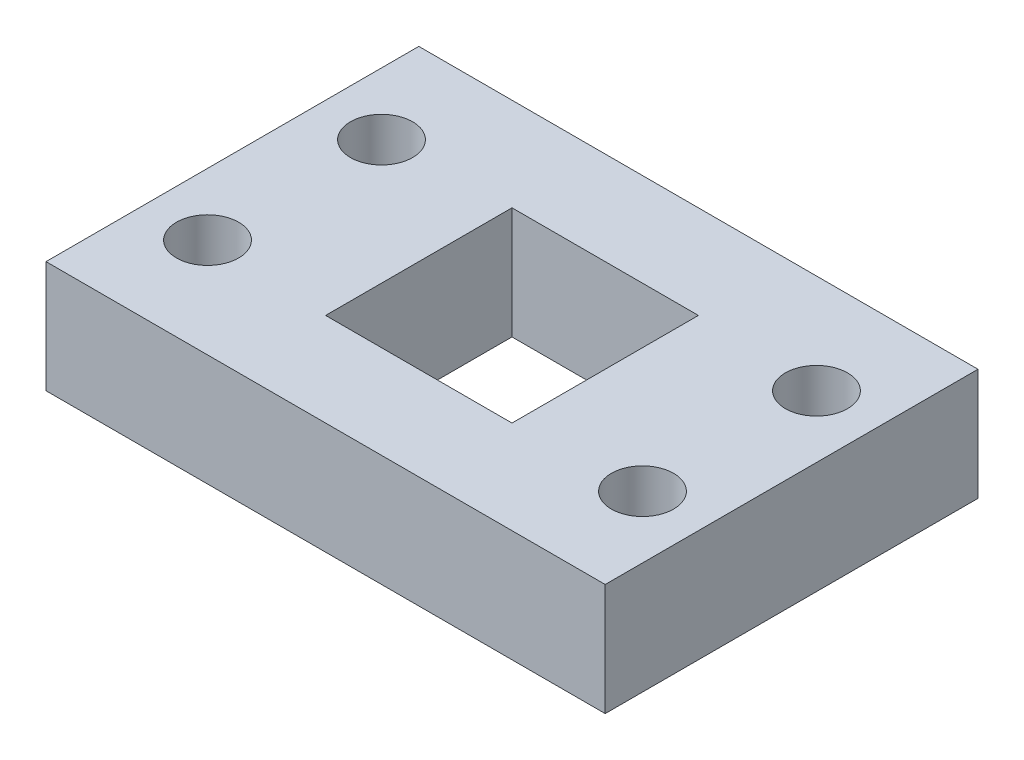
from build123d import *

# Parameters (mm, degrees)
CROQUIS1_W              = 45
CROQUIS1_H              = 30
SALIENTE_EXTRUIR1_DEPTH = 9
CROQUIS2_R              = 2.5
CROQUIS2_W              = 15
CROQUIS2_H              = 15
CORTAR_EXTRUIR1_DEPTH   = 10


with BuildPart() as part:
    # Croquis1 → Saliente-Extruir1 (new body)
    with BuildSketch(Plane(origin=(0, 0, 0), x_dir=(1, 0, 0), z_dir=(0, 1, 0))):
        with Locations((22.5, 15)):
            Rectangle(CROQUIS1_W, CROQUIS1_H)
    extrude(amount=SALIENTE_EXTRUIR1_DEPTH)

    # Croquis2 → Cortar-Extruir1 (cut)
    with BuildSketch(Plane(origin=(0, 9, 0), x_dir=(1, 0, 0), z_dir=(0, 1, 0))):
        with Locations(Location((5, 22, 0), (0, 0, 270))):
            Circle(CROQUIS2_R)
        with Locations(Location((5, 8, 0), (0, 0, 270))):
            Circle(CROQUIS2_R)
        with Locations(Location((40, 8, 0), (0, 0, 90))):
            Circle(CROQUIS2_R)
        with Locations(Location((40, 22, 0), (0, 0, 90))):
            Circle(CROQUIS2_R)
        with Locations((22.5, 15)):
            Rectangle(CROQUIS2_W, CROQUIS2_H)
    extrude(amount=-CORTAR_EXTRUIR1_DEPTH, mode=Mode.SUBTRACT)


solid = part.part
